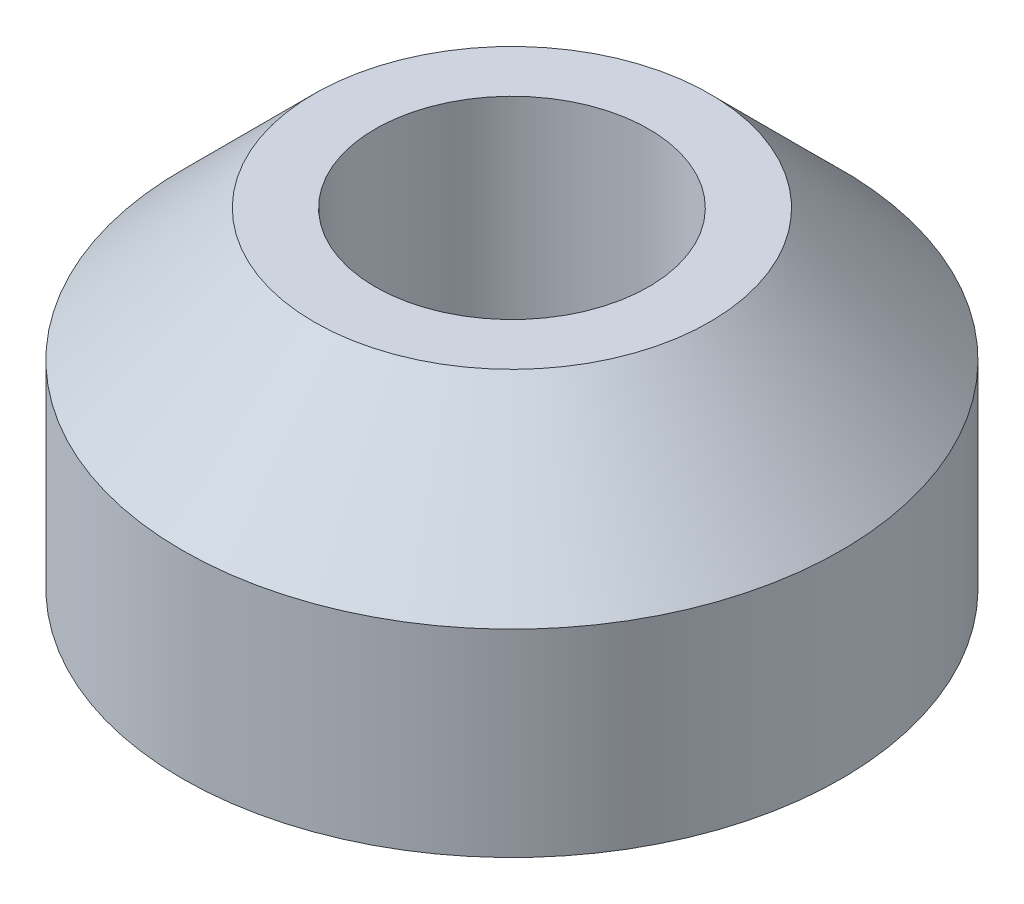
from build123d import *

# Parameters (mm, degrees)
SKETCH_1_R      = 10
SKETCH_1_R_2    = 4.15
EXTRUDE_1_DEPTH = 10
CHAMFER_1_SIZE  = 4


with BuildPart() as part:
    # 草图1 → 凸台-拉伸1 (new body)
    with BuildSketch(Plane(origin=(0, 0, 0), x_dir=(1, 0, 0), z_dir=(0, 1, 0))):
        with Locations(Location((0, 0, 0), (0, 0, 270))):
            Circle(SKETCH_1_R)
        with Locations(Location((0, 0, 0), (0, 0, 270))):
            Circle(SKETCH_1_R_2, mode=Mode.SUBTRACT)
    extrude(amount=EXTRUDE_1_DEPTH)

    # 倒角1
    chamfer_1_edges = [part.edges().sort_by_distance(p)[0] for p in [
        (0, 10, -10),
    ]]
    chamfer(chamfer_1_edges, length=CHAMFER_1_SIZE)


solid = part.part
